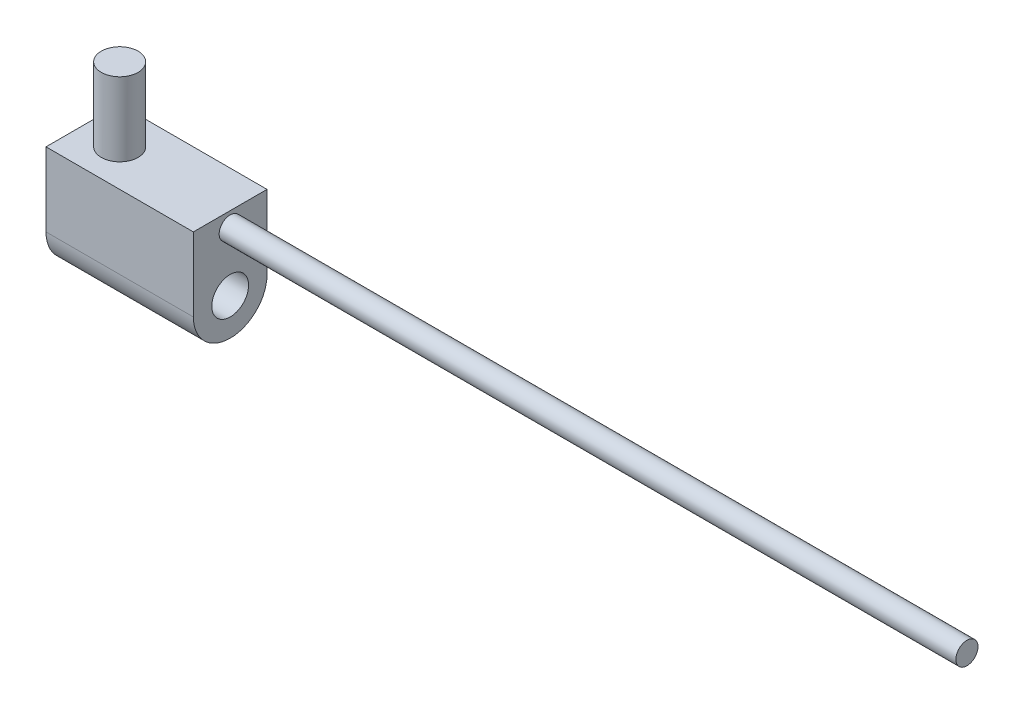
from build123d import *

# Parameters (mm, degrees)
SKETCH_1_W          = 10
SKETCH_1_H          = 15
EXTRUDE_1_DEPTH     = 20
FILLET_1_RADIUS     = 5
FILLET_1_LENGTH     = 20
SKETCH_2_R          = 2.5
EXTRUDE_2_DEPTH     = 10
SKETCH_3_R          = 2.5
CUT_EXTRUDE_1_DEPTH = 28.041634566
SKETCH_4_R          = 1.5
EXTRUDE_3_DEPTH     = 100


with BuildPart() as part:
    # 스케치1 → 보스-돌출1 (new body)
    with BuildSketch(Plane(origin=(0, 0, 0), x_dir=(0, 0, -1), z_dir=(1, 0, 0))):
        Rectangle(SKETCH_1_W, SKETCH_1_H)
    extrude(amount=EXTRUDE_1_DEPTH)

    # 필렛1: full round fillet: the end face becomes a half cylinder, R = half its width
    fillet_1_face = Plane((10, -7.5, 0), x_dir=(1, 0, 0), z_dir=(0, -1, 0))  # on the end face: x along it, z out of the body
    fillet_1_slab = fillet_1_face.offset(-FILLET_1_RADIUS / 2) * Box(FILLET_1_LENGTH, 2 * FILLET_1_RADIUS, FILLET_1_RADIUS, mode=Mode.PRIVATE)  # the body's end, R deep
    fillet_1_round = Plane((10, -2.5, 0), x_dir=(0, -1, 0), z_dir=(1, 0, 0)) * Cylinder(FILLET_1_RADIUS, FILLET_1_LENGTH, mode=Mode.PRIVATE)  # its axis R under the face
    add(fillet_1_slab - fillet_1_round, mode=Mode.SUBTRACT)

    # 스케치2 → 보스-돌출2 (add)
    with BuildSketch(Plane(origin=(0, 7.5, 0), x_dir=(1, 0, 0), z_dir=(0, 1, 0))):
        with Locations(Location((5, 0, 0), (0, 0, 90))):
            Circle(SKETCH_2_R)
    extrude(amount=EXTRUDE_2_DEPTH)

    # 스케치3 → 컷-돌출1 (cut, through all)
    with BuildSketch(Plane(origin=(20, 0, 0), x_dir=(0, 0, -1), z_dir=(1, 0, 0))):
        with Locations((0, -2.5)):
            Circle(SKETCH_3_R)
    extrude(amount=-CUT_EXTRUDE_1_DEPTH, mode=Mode.SUBTRACT)

    # 스케치4 → 보스-돌출3 (add)
    with BuildSketch(Plane(origin=(20, 0, 0), x_dir=(0, 0, -1), z_dir=(1, 0, 0))):
        with Locations((0, 5.5)):
            Circle(SKETCH_4_R)
    extrude(amount=EXTRUDE_3_DEPTH)


solid = part.part
